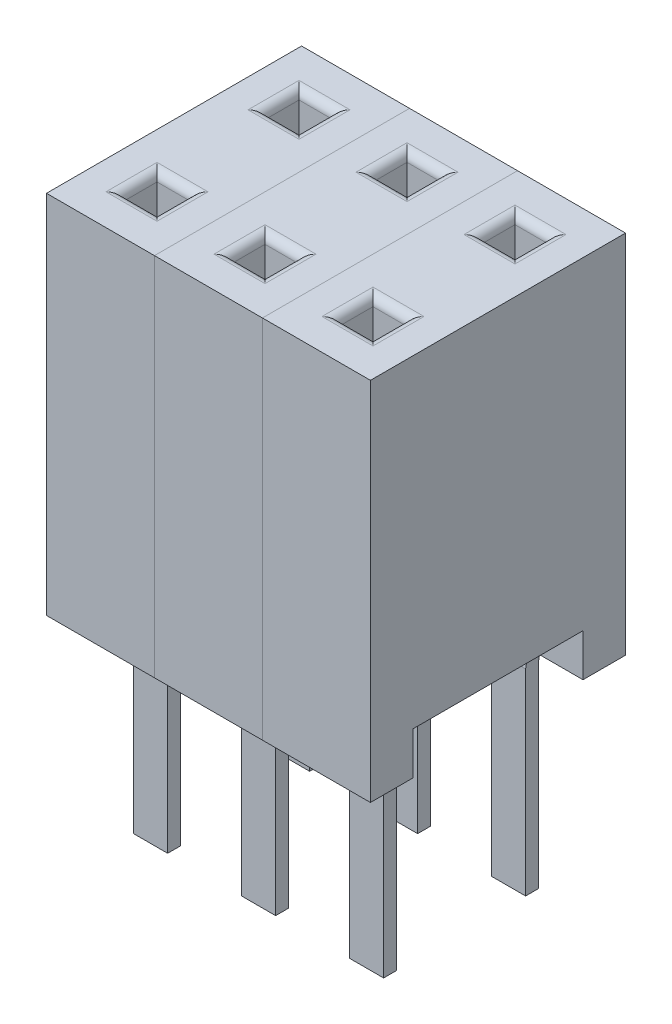
from build123d import *

# Parameters (mm, degrees)
SKETCH_1_W               = 1.27
SKETCH_1_H               = 3
EXTRUDE_1_DEPTH          = 4.3
CUT_EXTRUDE_2_DEPTH      = 5.598176269
CUT_EXTRUDE_2_DEPTH_BACK = 5.598176269
SKETCH_3_W               = 2
SKETCH_3_H               = 0.5
SKETCH_5_W               = 0.4
SKETCH_5_H               = 0.4
CUT_EXTRUDE_3_DEPTH      = 2.8
FILLET_2_R               = 0.1
EXTRUDE_3_DEPTH          = 0.2
PATTERN_LINEAR_2_COUNT   = 3
PATTERN_LINEAR_2_PITCH   = 1.27


with BuildPart() as part:
    # 草图1 → 凸台-拉伸1 (new body)
    with BuildSketch(Plane(origin=(0, 0, 0), x_dir=(1, 0, 0), z_dir=(0, 1, 0))):
        Rectangle(SKETCH_1_W, SKETCH_1_H)
    extrude(amount=EXTRUDE_1_DEPTH)

    # 草图3 → 切除-拉伸2 (cut, two sides: drawn at the far end of the back side and taken through both)
    with BuildSketch(Plane(origin=(0, 0, 0), x_dir=(0, 0, -1), z_dir=(1, 0, 0)).offset(-CUT_EXTRUDE_2_DEPTH_BACK)):
        with Locations((0, 0.25)):
            Rectangle(SKETCH_3_W, SKETCH_3_H)
    extrude(amount=CUT_EXTRUDE_2_DEPTH + CUT_EXTRUDE_2_DEPTH_BACK, mode=Mode.SUBTRACT)

    # 草图5 → 切除-拉伸3 (cut)
    with BuildSketch(Plane(origin=(0, 4.3, 0), x_dir=(1, 0, 0), z_dir=(0, 1, 0))):
        with Locations((0, 0.835)):
            Rectangle(SKETCH_5_W, SKETCH_5_H)
        with Locations((0, -0.835)):
            Rectangle(SKETCH_5_W, SKETCH_5_H)
    extrude(amount=-CUT_EXTRUDE_3_DEPTH, mode=Mode.SUBTRACT)

    # 圆角2
    fillet_2_edges = [part.edges().sort_by_distance(p)[0] for p in [
        (-0.2, 4.3, -0.835),
        (0, 4.3, -0.635),
        (0.2, 4.3, -0.835),
        (0, 4.3, -1.035),
        (-0.2, 4.3, 0.835),
        (0, 4.3, 1.035),
        (0.2, 4.3, 0.835),
        (0, 4.3, 0.635),
    ]]
    fillet(fillet_2_edges, radius=FILLET_2_R)

    # 草图6 → 凸台-拉伸3 (add, symmetric)
    with BuildSketch(Plane(origin=(0, 0, 0), x_dir=(0, 0, -1), z_dir=(1, 0, 0))):
        Polygon((1, 0.5), (0.91, 0), (0.91, -2.3), (0.76, -2.3), (0.76, 0.013392386), (0.84758937, 0.5), align=None)
        Polygon((-0.76, 0.013392386), (-0.84758937, 0.5), (-1, 0.5), (-0.91, 0), (-0.91, -2.3), (-0.76, -2.3), align=None)
    extrude(amount=EXTRUDE_3_DEPTH, both=True)


with BuildPart() as pattern_linear_2_1:
    # 阵列(线性)2: pattern copy
    add(part.part.moved(Location(Vector(1, 0, 0) * (1 * PATTERN_LINEAR_2_PITCH))))


with BuildPart() as pattern_linear_2_2:
    # 阵列(线性)2: pattern copy
    add(part.part.moved(Location(Vector(1, 0, 0) * (2 * PATTERN_LINEAR_2_PITCH))))


solid = Compound([part.part, pattern_linear_2_1.part, pattern_linear_2_2.part])
